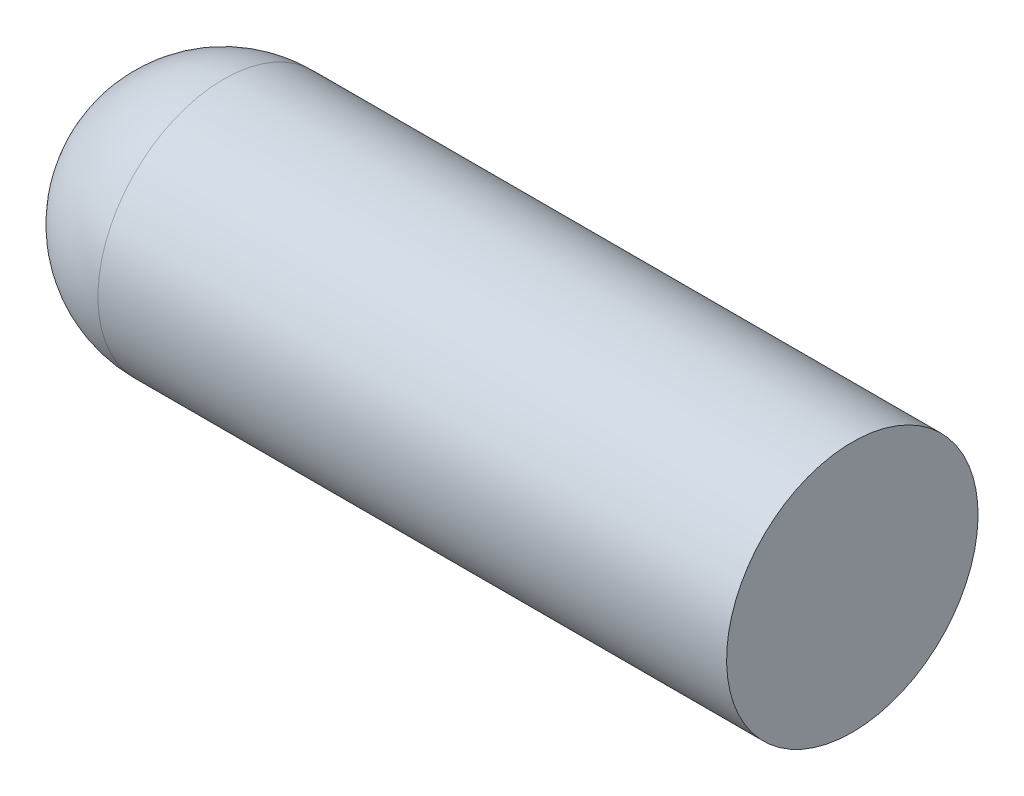
from build123d import *


with BuildPart() as part:
    # Sketch8 → Revolve8 (revolve)
    with BuildSketch(Plane.XY):
        with BuildLine():
            Line((508, 0), (0, 0))
            add(Edge.make_bspline(
                [(0, 0), (0.002822011, 0.011220682), (0.01010376, 0.033028979), (0.031502321, 0.074017024), (0.069784833, 0.131646678), (0.119222388, 0.195375451), (0.189812425, 0.276067496), (0.274835356, 0.363880791), (0.401947452, 0.484306453), (0.602624186, 0.656685654), (0.914446886, 0.898448081), (1.444794417, 1.267055392), (2.342189308, 1.821854316), (3.926219982, 2.68636524), (6.792153336, 4.05339861), (11.891147147, 6.162529219), (20.431057711, 9.216107653), (31.891623295, 12.776951203), (45.625686568, 16.59500746), (64.715206078, 21.439103902), (87.842839522, 26.755548696), (115.260857413, 32.475768916), (146.98211669, 38.485522007), (178.789638074, 44.017933119), (210.666331669, 49.135593448), (242.60094075, 53.877496918), (274.585932559, 58.26635678), (306.615943821, 62.313330004), (338.687218842, 66.019317565), (370.797101622, 69.374815155), (402.943853119, 72.357821551), (431.103668314, 74.606208089), (455.262955994, 76.229190957), (474.443672775, 77.278006717), (487.103143355, 77.83586579), (497.267203511, 78.174386426), (503.399758723, 78.310011701), (506.466506539, 78.353386553), (508, 78.359)],
                knots=[0, 0, 0, 0, 0, 8.9262e-05, 0.000178524, 0.000357048, 0.000535573, 0.000714097, 0.001009141, 0.001304186, 0.001892408, 0.002763912, 0.00406622, 0.006308364, 0.010066681, 0.016745451, 0.028667746, 0.049062689, 0.080343506, 0.109747473, 0.13915144, 0.201713099, 0.264274768, 0.326836438, 0.389398105, 0.451959776, 0.514521446, 0.577083113, 0.639644785, 0.702206453, 0.764768123, 0.827329793, 0.889891462, 0.921172297, 0.952453131, 0.976226566, 0.988113283, 1, 1, 1, 1, 1], degree=4))
            Line((508, 78.359), (762, 78.359))
            Line((762, 78.359), (762, 0))
            Line((762, 0), (508, 0))
        make_face()
    revolve(axis=Axis((508, 0, 0), (-1, 0, 0)))


with BuildPart() as body_2:
    # Sketch9 → Revolve9 (revolve)
    with BuildSketch(Plane.XY):
        with BuildLine():
            Line((-762, 0), (3809.999961401, 0))
            Line((3809.999961401, 0), (3809.999961401, 762))
            Line((3809.999961401, 762), (3.8599e-05, 762))
            ThreePointArc((3.8599e-05, 762), (-538.815353617, 538.815380911), (-762, 0))
        make_face()
    revolve(axis=Axis((-762, 0, 0), (1, 0, 0)))

    # Combine1: cut part
    add(part.part, mode=Mode.SUBTRACT)


solid = body_2.part
